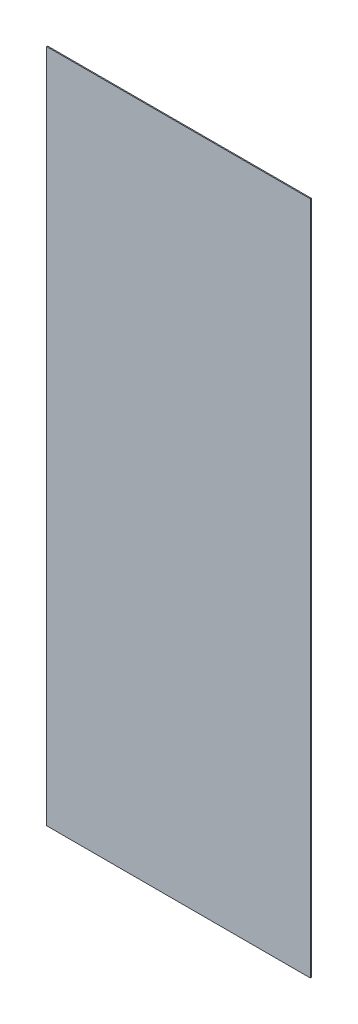
from build123d import *

# Parameters (mm, degrees)
CROQUIS1_W              = 500
CROQUIS1_H              = 1280
SALIENTE_EXTRUIR1_DEPTH = 1.9


with BuildPart() as part:
    # Croquis1 → Saliente-Extruir1 (new body)
    with BuildSketch(Plane.XY):
        Rectangle(CROQUIS1_W, CROQUIS1_H)
    extrude(amount=SALIENTE_EXTRUIR1_DEPTH)


solid = part.part
